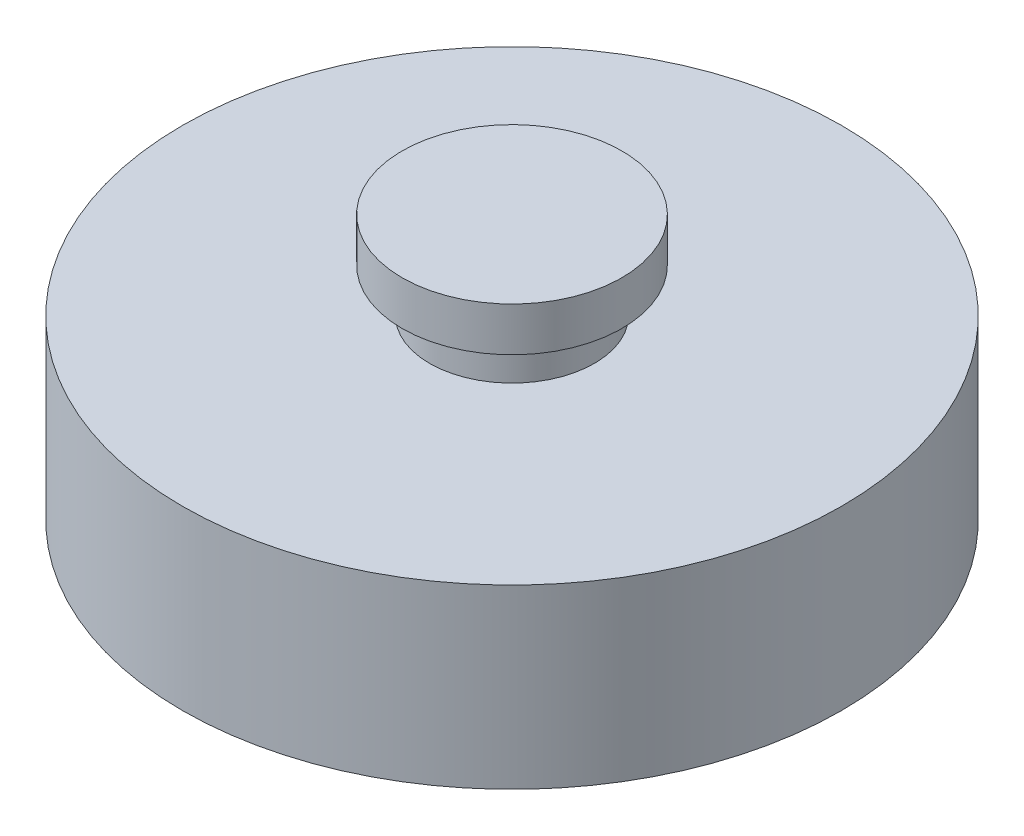
from build123d import *

# Parameters (mm, degrees)
SKETCH1_R           = 300
BOSS_EXTRUDE1_DEPTH = 161
SKETCH2_R           = 75
BOSS_EXTRUDE2_DEPTH = 40
SKETCH3_R           = 100
BOSS_EXTRUDE3_DEPTH = 40


with BuildPart() as part:
    # Sketch1 → Boss-Extrude1 (new body)
    with BuildSketch(Plane(origin=(0, 0, 0), x_dir=(1, 0, 0), z_dir=(0, 1, 0))):
        with Locations(Location((0, 0, 0), (0, 0, 270))):
            Circle(SKETCH1_R)
    extrude(amount=BOSS_EXTRUDE1_DEPTH)

    # Sketch2 → Boss-Extrude2 (add)
    with BuildSketch(Plane(origin=(0, 161, 0), x_dir=(1, 0, 0), z_dir=(0, 1, 0))):
        with Locations(Location((0, 0, 0), (0, 0, 270))):
            Circle(SKETCH2_R)
    extrude(amount=BOSS_EXTRUDE2_DEPTH)

    # Sketch3 → Boss-Extrude3 (add)
    with BuildSketch(Plane(origin=(0, 201, 0), x_dir=(1, 0, 0), z_dir=(0, 1, 0))):
        with Locations(Location((0, 0, 0), (0, 0, 270))):
            Circle(SKETCH3_R)
    extrude(amount=BOSS_EXTRUDE3_DEPTH)


solid = part.part
